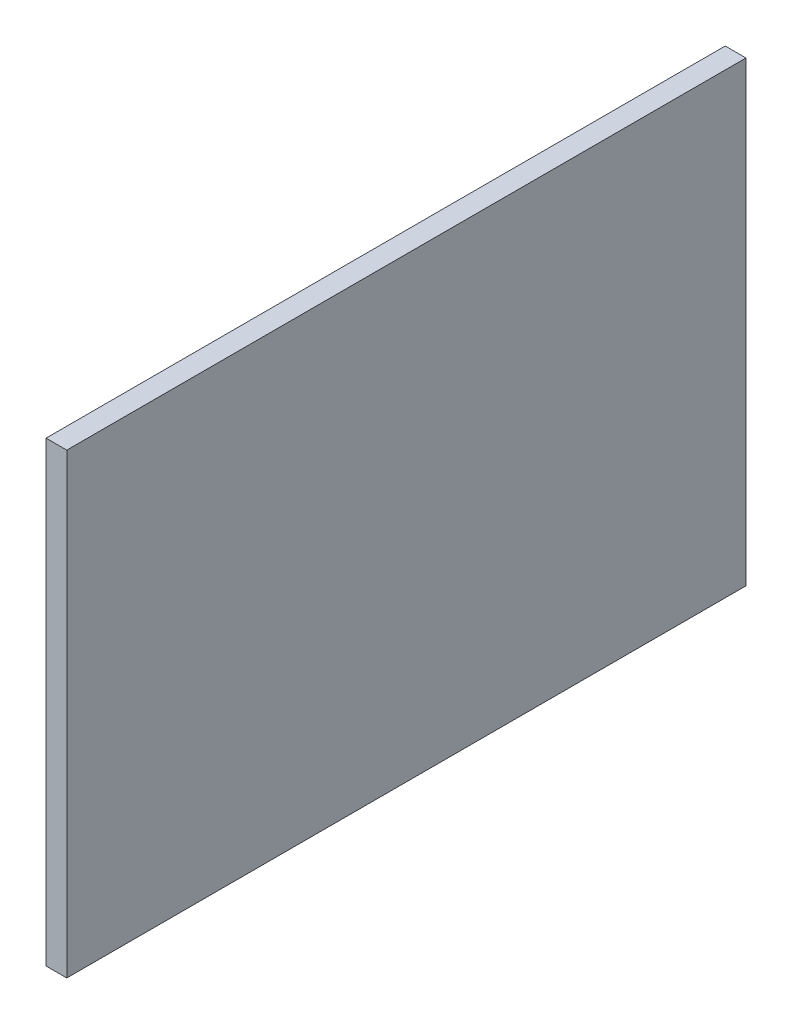
from build123d import *

# Parameters (mm, degrees)
SKETCH1_W           = 104
SKETCH1_H           = 70
BOSS_EXTRUDE1_DEPTH = 3.175


with BuildPart() as part:
    # Sketch1 → Boss-Extrude1 (new body)
    with BuildSketch(Plane(origin=(0, 0, 0), x_dir=(0, 0, -1), z_dir=(1, 0, 0))):
        with Locations((52, 35)):
            Rectangle(SKETCH1_W, SKETCH1_H)
    extrude(amount=BOSS_EXTRUDE1_DEPTH)


solid = part.part
